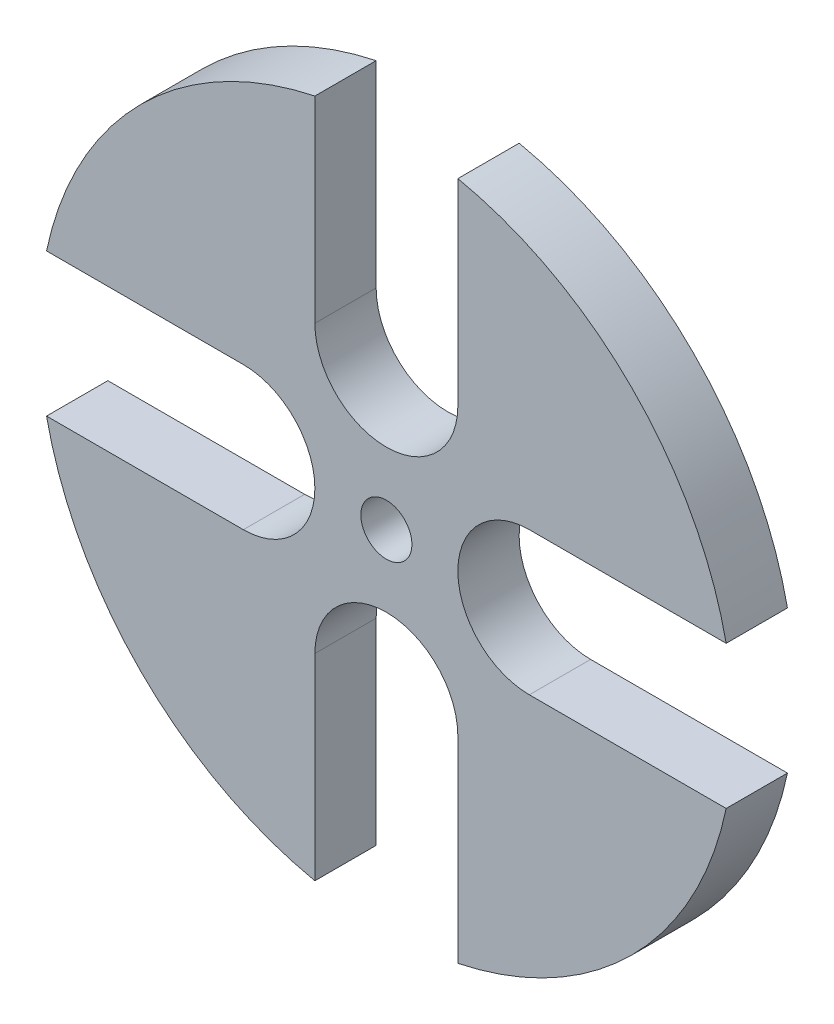
from build123d import *

# Parameters (mm, degrees)
SKETCH_1_R      = 1.25
EXTRUDE_1_DEPTH = 3


with BuildPart() as part:
    # 草图1 → 凸台-拉伸1 (new body)
    with BuildSketch(Plane.XY):
        with BuildLine():
            ThreePointArc((3.5, 7), (0, 3.5), (-3.5, 7))
            Line((-3.5, 7), (-3.5, 16.63580476))
            ThreePointArc((-3.5, 16.63580476), (-12.02081528, 12.02081528), (-16.63580476, 3.5))
            Line((-16.63580476, 3.5), (-7, 3.5))
            ThreePointArc((-7, 3.5), (-4.525126266, 2.474873734), (-3.5, 0))
            ThreePointArc((-3.5, 0), (-4.525126266, -2.474873734), (-7, -3.5))
            Line((-7, -3.5), (-16.63580476, -3.5))
            ThreePointArc((-16.63580476, -3.5), (-12.02081528, -12.02081528), (-3.5, -16.63580476))
            Line((-3.5, -16.63580476), (-3.5, -7))
            ThreePointArc((-3.5, -7), (0, -3.5), (3.5, -7))
            Line((3.5, -7), (3.5, -16.63580476))
            ThreePointArc((3.5, -16.63580476), (12.02081528, -12.02081528), (16.63580476, -3.5))
            Line((16.63580476, -3.5), (7, -3.5))
            ThreePointArc((7, -3.5), (3.5, 0), (7, 3.5))
            Line((7, 3.5), (16.63580476, 3.5))
            ThreePointArc((16.63580476, 3.5), (12.02081528, 12.02081528), (3.5, 16.63580476))
            Line((3.5, 16.63580476), (3.5, 7))
        make_face()
        Circle(SKETCH_1_R, mode=Mode.SUBTRACT)
    extrude(amount=EXTRUDE_1_DEPTH)


solid = part.part
